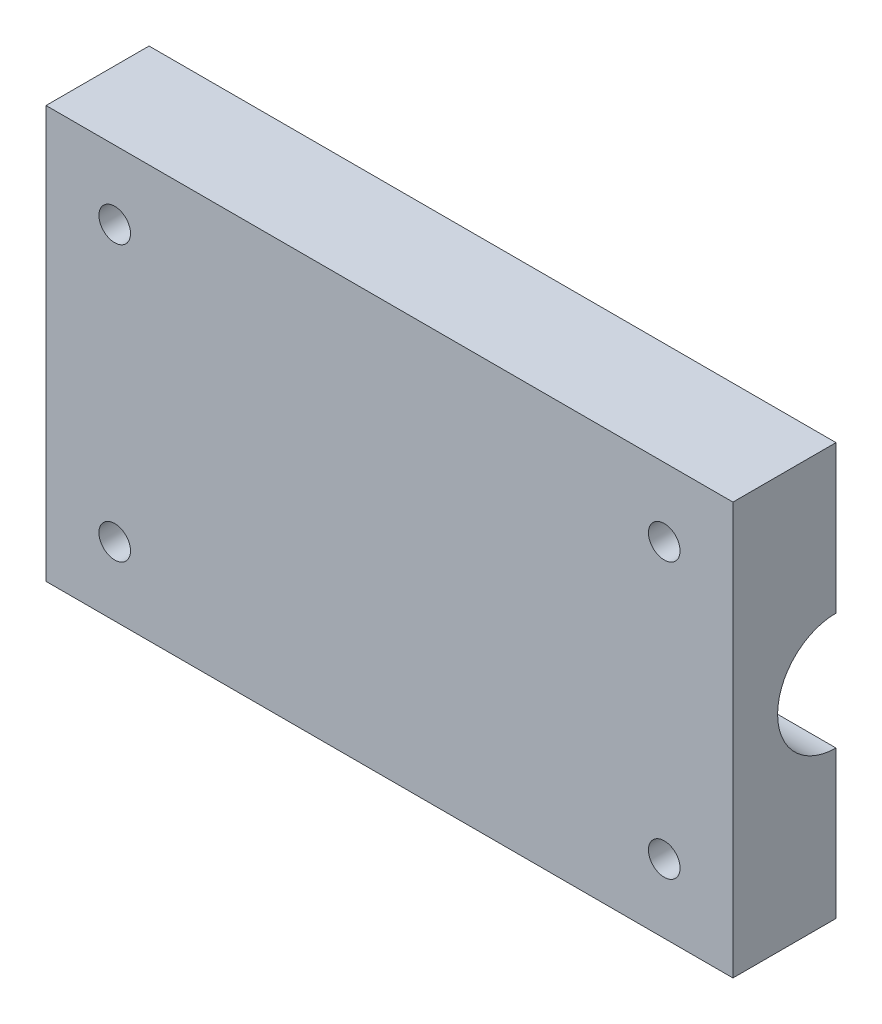
from build123d import *

# Parameters (mm, degrees)
SKETCH1_W           = 100
SKETCH1_H           = 60
SKETCH1_R           = 2.3
BOSS_EXTRUDE1_DEPTH = 15
SKETCH2_R           = 8.5
CUT_EXTRUDE1_DEPTH  = 200


with BuildPart() as part:
    # Sketch1 → Boss-Extrude1 (new body)
    with BuildSketch(Plane.XY):
        Rectangle(SKETCH1_W, SKETCH1_H)
        with Locations((-40, -20)):
            Circle(SKETCH1_R, mode=Mode.SUBTRACT)
        with Locations(Location((40, -20, 0), (0, 0, 180))):
            Circle(SKETCH1_R, mode=Mode.SUBTRACT)
        with Locations((40, 20)):
            Circle(SKETCH1_R, mode=Mode.SUBTRACT)
        with Locations(Location((-40, 20, 0), (0, 0, 180))):
            Circle(SKETCH1_R, mode=Mode.SUBTRACT)
    extrude(amount=BOSS_EXTRUDE1_DEPTH)

    # Sketch2 → Cut-Extrude1 (cut, symmetric)
    with BuildSketch(Plane.ZY.offset(50)):
        Circle(SKETCH2_R)
    extrude(amount=CUT_EXTRUDE1_DEPTH, both=True, mode=Mode.SUBTRACT)


solid = part.part
